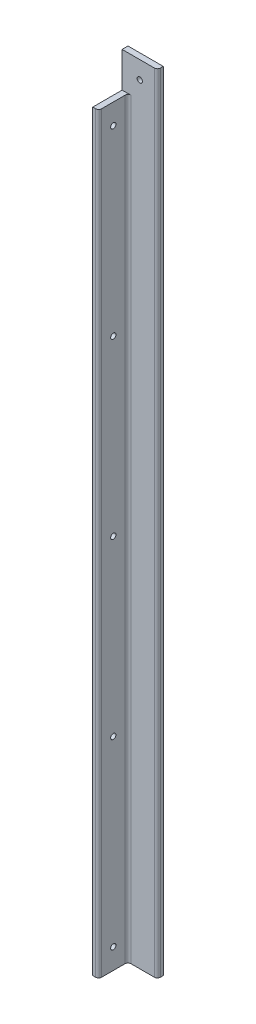
from build123d import *

# Parameters (mm, degrees)
BOSS_EXTRUDE1_DEPTH = 431.8
SKETCH4_W           = 15.875
SKETCH4_H           = 25.4
CUT_EXTRUDE1_DEPTH  = 6.35
SKETCH5_W           = 1.5875
SKETCH5_H           = 25.4
CUT_EXTRUDE2_DEPTH  = 6.35
SKETCH6_R           = 1.4224
CUT_EXTRUDE3_DEPTH  = 5.08
CUT_EXTRUDE4_START  = -6.35
CUT_EXTRUDE4_DEPTH  = 6.35
SKETCH8_R           = 1.4224
CUT_EXTRUDE5_DEPTH  = 5.08
SKETCH9_W           = 28.861002292
SKETCH9_H           = 547.524656259
CUT_EXTRUDE6_DEPTH  = 30.48


with BuildPart() as part:
    # Sketch2 → Boss-Extrude1 (new body)
    with BuildSketch(Plane(origin=(0, 0, 0), x_dir=(1, 0, 0), z_dir=(0, 1, 0))):
        with BuildLine():
            Line((0, 0), (19.05, 0))
            Line((19.05, 0), (19.05, 1.5875))
            ThreePointArc((19.05, 1.5875), (18.585032015, 2.710032015), (17.4625, 3.175))
            Line((17.4625, 3.175), (4.7625, 3.175))
            ThreePointArc((4.7625, 3.175), (3.639967985, 3.639967985), (3.175, 4.7625))
            Line((3.175, 4.7625), (3.175, 17.4625))
            ThreePointArc((3.175, 17.4625), (2.710032015, 18.585032015), (1.5875, 19.05))
            Line((1.5875, 19.05), (0, 19.05))
            Line((0, 19.05), (0, 0))
        make_face()
    extrude(amount=BOSS_EXTRUDE1_DEPTH)

    # Sketch4 → Cut-Extrude1 (cut)
    with BuildSketch(Plane(origin=(3.175, 0, 0), x_dir=(0, 0, -1), z_dir=(1, 0, 0))):
        with Locations((11.1125, 419.1)):
            Rectangle(SKETCH4_W, SKETCH4_H)
    extrude(amount=-CUT_EXTRUDE1_DEPTH, mode=Mode.SUBTRACT)

    # Sketch5 → Cut-Extrude2 (cut)
    with BuildSketch(Plane.ZY.offset(-3.175)):
        with Locations((-3.96875, 419.1)):
            Rectangle(SKETCH5_W, SKETCH5_H)
    extrude(amount=-CUT_EXTRUDE2_DEPTH, mode=Mode.SUBTRACT)

    # Sketch6 → Cut-Extrude3 (cut)
    with BuildSketch(Plane(origin=(3.175, 0, 0), x_dir=(0, 0, -1), z_dir=(1, 0, 0))):
        with Locations((11.1125, 109.5375)):
            Circle(SKETCH6_R)
        with Locations((11.1125, 203.2)):
            Circle(SKETCH6_R)
        with Locations((11.1125, 296.8625)):
            Circle(SKETCH6_R)
        with Locations((11.1125, 11.1125)):
            Circle(SKETCH6_R)
        with Locations((11.1125, 395.2875)):
            Circle(SKETCH6_R)
    extrude(amount=-CUT_EXTRUDE3_DEPTH, mode=Mode.SUBTRACT)

    # Sketch7 → Cut-Extrude4 (cut)
    with BuildSketch(Plane(origin=(0, 431.8, 0), x_dir=(1, 0, 0), z_dir=(0, 1, 0)).offset(CUT_EXTRUDE4_START)):
        with BuildLine():
            Line((17.4625, 3.175), (0, 3.175))
            Line((0, 3.175), (0, 0))
            Line((0, 0), (19.05, 0))
            Line((19.05, 0), (19.05, 1.5875))
            ThreePointArc((19.05, 1.5875), (18.585032015, 2.710032015), (17.4625, 3.175))
        make_face()
    extrude(amount=CUT_EXTRUDE4_DEPTH, mode=Mode.SUBTRACT)

    # Sketch8 → Cut-Extrude5 (cut)
    with BuildSketch(Plane(origin=(0, 0, -3.175), x_dir=(-1, 0, 0), z_dir=(0, 0, -1))):
        with Locations((-9.525, 415.925)):
            Circle(SKETCH8_R)
    extrude(amount=-CUT_EXTRUDE5_DEPTH, mode=Mode.SUBTRACT)


with BuildPart() as body_2:
    # Mirror3: mirrored copy
    add(part.part.mirror(Plane.XY.offset(2.54)))


with BuildPart() as part_1:
    add(part.part)

    # Sketch9 → Cut-Extrude6 (cut)
    with BuildSketch(Plane.XY.offset(2.54)):
        with Locations((7.805746781, 195.778589833)):
            Rectangle(SKETCH9_W, SKETCH9_H)
    extrude(amount=-CUT_EXTRUDE6_DEPTH, mode=Mode.SUBTRACT)


solid = body_2.part
